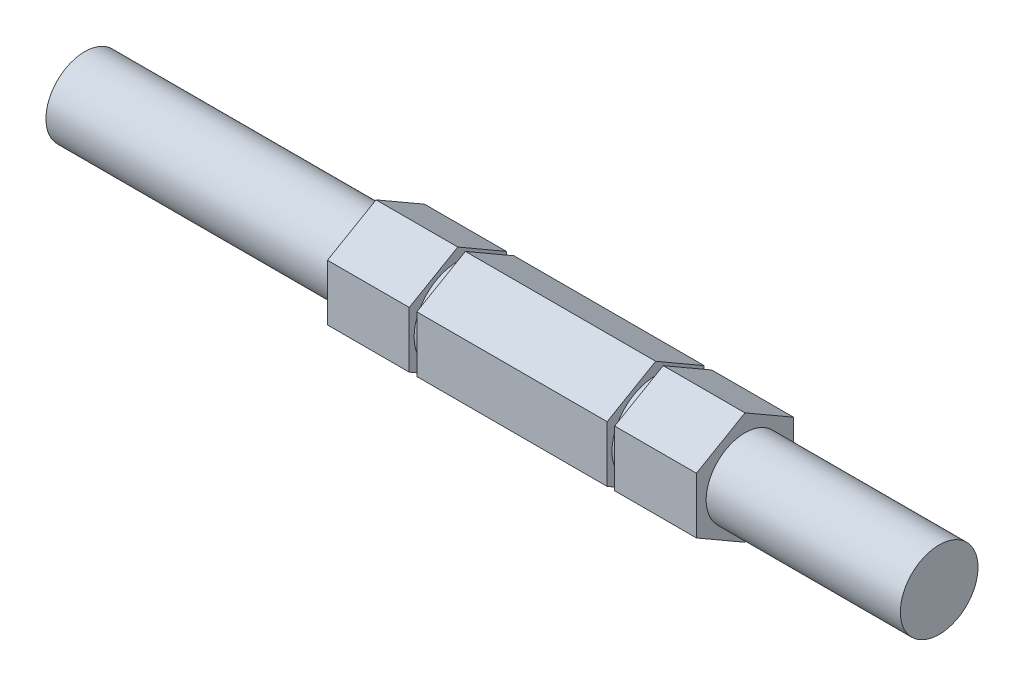
from build123d import *

# Parameters (mm, degrees)
BOSS_EXTRUDE1_DEPTH = 48.26
SKETCH4_R           = 5.08
BOSS_EXTRUDE2_DEPTH = 38.1
BOSS_EXTRUDE3_START = 25.4
SKETCH5_R           = 5.08
BOSS_EXTRUDE3_DEPTH = 25.4
SKETCH3_W           = 0.9906
SKETCH3_H           = 2.218819971


with BuildPart() as part:
    # Sketch1 → Boss-Extrude1 (new body)
    with BuildSketch(Plane(origin=(0, 0, 0), x_dir=(0, 0, -1), z_dir=(1, 0, 0))):
        Polygon((0, -7.332348419), (6.35, -3.666174209), (6.35, 3.666174209), (0, 7.332348419), (-6.35, 3.666174209), (-6.35, -3.666174209), align=None)
    extrude(amount=BOSS_EXTRUDE1_DEPTH)

    # Sketch4 → Boss-Extrude2 (add)
    with BuildSketch(Plane.ZY):
        with Locations(Location((0, 0, 0), (0, 0, 180))):
            Circle(SKETCH4_R)
    extrude(amount=BOSS_EXTRUDE2_DEPTH)

    # Sketch5 → Boss-Extrude3 (add)
    with BuildSketch(Plane(origin=(48.26, 0, 0), x_dir=(0, 0, -1), z_dir=(1, 0, 0)).offset(BOSS_EXTRUDE3_START)):
        Circle(SKETCH5_R)
    extrude(amount=-BOSS_EXTRUDE3_DEPTH)

    # Sketch3 → Cut-Revolve2 (revolve, cut)
    with BuildSketch(Plane(origin=(0, 0, 0), x_dir=(1, 0, 0), z_dir=(0, 1, 0)), mode=Mode.PRIVATE) as cut_revolve2_sk:
        with Locations((37.0713, 6.824409986)):
            Rectangle(SKETCH3_W, SKETCH3_H)
        with Locations((11.1887, 6.824409986)):
            Rectangle(SKETCH3_W, SKETCH3_H)
    revolve(cut_revolve2_sk.sketch.rotate(Axis((-57.594560376, 0, 0), (1, 0, 0)), 180), axis=Axis((-57.594560376, 0, 0), (1, 0, 0)), mode=Mode.SUBTRACT)


solid = part.part
